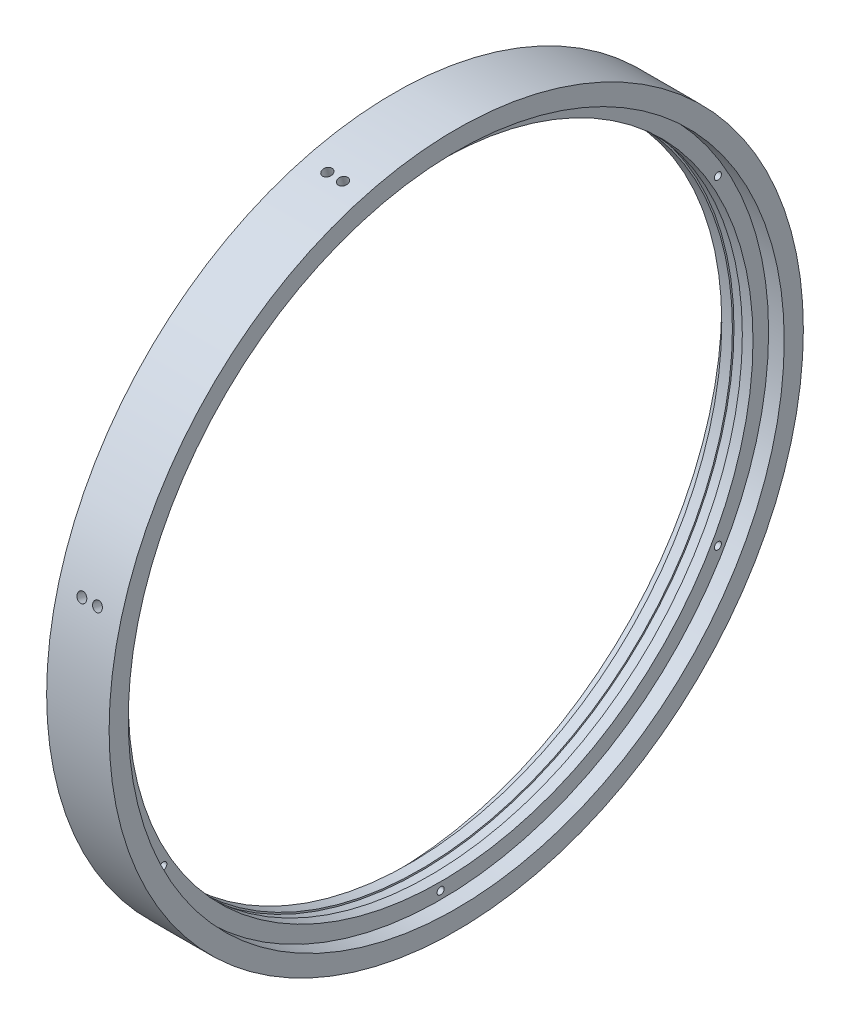
from build123d import *

# Parameters (mm, degrees)
TAP_DRILL_FOR_4_40_TAP1_D     = 2.2606
TAP_DRILL_FOR_4_40_TAP1_DEPTH = 8.89
TAP_DRILL_FOR_4_40_TAP1_TIP   = 0.679152758
TAP_DRILL_FOR_4_40_TAP2_D     = 2.2606
TAP_DRILL_FOR_4_40_TAP2_DEPTH = 8.89
TAP_DRILL_FOR_4_40_TAP2_TIP   = 0.679152758
SKETCH8_R                     = 1.524
CUT_EXTRUDE1_DEPTH            = 8.89
CIRPATTERN1_COUNT             = 6


with BuildPart() as part:
    # Sketch3 → Revolve1 (revolve)
    with BuildSketch(Plane(origin=(0, 0, 0), x_dir=(1, 0, 0), z_dir=(0, 1, 0))):
        Polygon((-10, -111.125), (10, -111.125), (10, -105), (5, -105), (5, -100), (1.5875, -100), (1.5875, -100.5), (-1.5875, -100.5), (-1.5875, -100), (-5, -100), (-5, -105), (-10, -105), align=None)
    revolve(axis=Axis((0, 0, 0), (-1, 0, 0)))

    # Tap Drill for #4-40 Tap1
    with Locations(Plane(origin=(5, -102.5, 0), x_dir=(0, 0, 1), z_dir=(1, 0, 0))):
        with Locations((0, 0), (88.767603888, -51.25), (-88.767603888, -51.25), (-88.767603888, -153.75), (0, -205), (88.767603888, -153.75)):
            Hole(TAP_DRILL_FOR_4_40_TAP1_D / 2, depth=TAP_DRILL_FOR_4_40_TAP1_DEPTH)
            with Locations((0, 0, -(TAP_DRILL_FOR_4_40_TAP1_DEPTH + TAP_DRILL_FOR_4_40_TAP1_TIP / 2))):  # 118° drill point
                Cone(0, TAP_DRILL_FOR_4_40_TAP1_D / 2, TAP_DRILL_FOR_4_40_TAP1_TIP, mode=Mode.SUBTRACT)

    # Tap Drill for #4-40 Tap2
    with Locations(Plane(origin=(-5, -88.767603888, 51.25), x_dir=(0, 0, -1), z_dir=(-1, 0, 0))):
        with Locations((0, 0), (-51.25, -88.767603888), (0, -177.535207776), (102.5, -177.535207776), (153.75, -88.767603888), (102.5, 0)):
            Hole(TAP_DRILL_FOR_4_40_TAP2_D / 2, depth=TAP_DRILL_FOR_4_40_TAP2_DEPTH)
            with Locations((0, 0, -(TAP_DRILL_FOR_4_40_TAP2_DEPTH + TAP_DRILL_FOR_4_40_TAP2_TIP / 2))):  # 118° drill point
                Cone(0, TAP_DRILL_FOR_4_40_TAP2_D / 2, TAP_DRILL_FOR_4_40_TAP2_TIP, mode=Mode.SUBTRACT)

    # Sketch8 → Cut-Extrude1 (cut)
    with BuildSketch(Plane(origin=(0, 107.338507446, 28.761266387), x_dir=(-1, 0, 0), z_dir=(0, 0.9659258262890681, 0.25881904510252135))):
        with Locations((-2.5, 0)):
            Circle(SKETCH8_R)
        with Locations((2.5, 0)):
            Circle(SKETCH8_R)
    cut_extrude1 = extrude(amount=-CUT_EXTRUDE1_DEPTH, mode=Mode.SUBTRACT)

    # CirPattern1: Cut-Extrude1 ×6 about axis
    cirpattern1_axis = Axis((-10, 0, 0), (1, 0, 0))
    for i in range(1, CIRPATTERN1_COUNT):
        add(cut_extrude1.rotate(cirpattern1_axis, i * 360 / CIRPATTERN1_COUNT), mode=Mode.SUBTRACT)


solid = part.part
